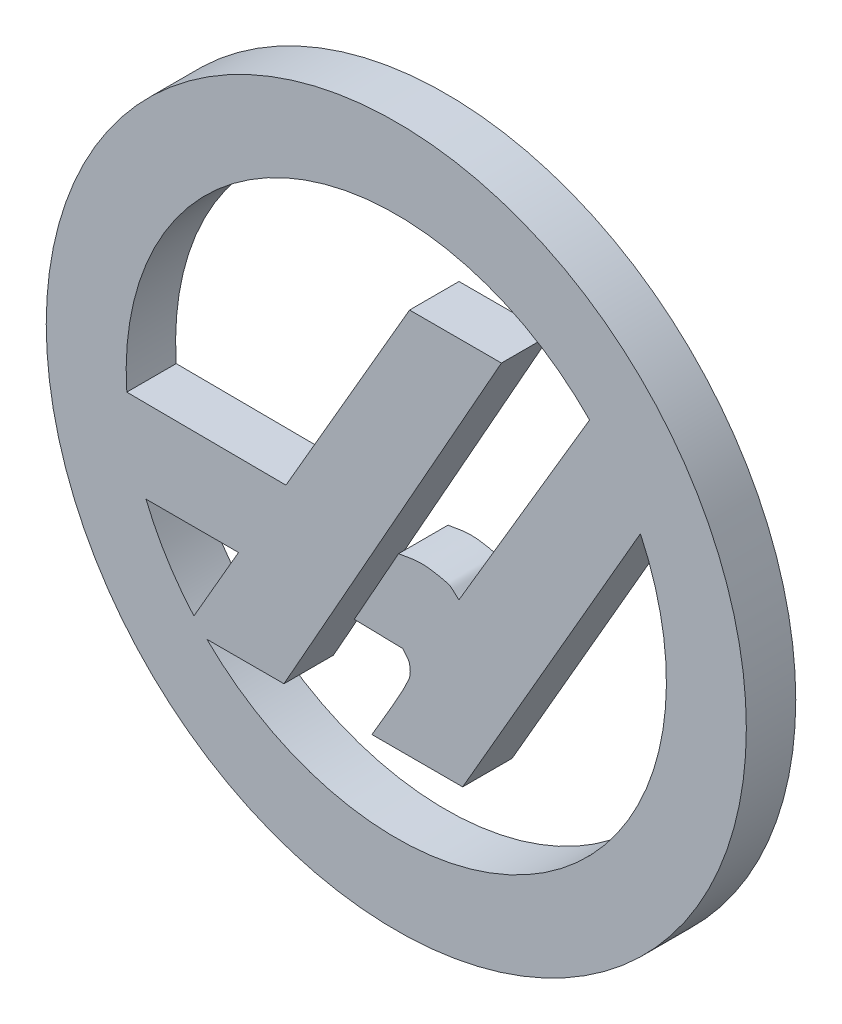
from build123d import *

# Parameters (mm, degrees)
SKETCH1_R           = 354.154198638
BOSS_EXTRUDE4_DEPTH = 50


with BuildPart() as part:
    # Sketch1 → Boss-Extrude4 (new body)
    with BuildSketch(Plane.XY):
        with Locations((456.634031844, 370.797239723)):
            Circle(SKETCH1_R)
        with BuildLine():
            Line((652.184505988, 561.696856288), (520, 338))
            add(Edge.make_bspline(
                [(520, 338), (516, 341), (512.856486558, 345.810656353), (508, 347), (483.294181497, 353.050404531), (477.851743634, 351.141957272), (459, 348)],
                knots=[0, 0, 0, 0, 1, 1, 1, 2, 2, 2, 2], degree=3))
            Line((459, 348), (414.15311107, 268.000000001))
            Line((414.15311107, 268.000000001), (463, 267))
            add(Edge.make_bspline(
                [(463, 267), (465.333333333, 263.666666667), (469.050440025, 260.956499894), (470, 257), (471.16945492, 252.127271165), (471.128314939, 246.536671316), (469, 242), (458.288028235, 219.166586501), (444.333333333, 198), (432, 176)],
                knots=[0, 0, 0, 0, 1, 1, 1, 2, 2, 2, 3, 3, 3, 3], degree=3))
            Line((432, 176), (523.783724069, 176))
            Line((523.783724069, 176), (703.607534398, 487.787583679))
            ThreePointArc((703.607534398, 487.787583679), (614.979125151, 148.065376335), (264.996930573, 175.96943637))
            Line((264.996930573, 175.96943637), (342.999405137, 176))
            Line((342.999405137, 176), (562.999999995, 567.000000012))
            Line((562.999999995, 567.000000012), (470.080751257, 567.000000012))
            Line((470.080751257, 567.000000012), (344.999999995, 351.000000012))
            Line((344.999999995, 351.000000012), (183.999999995, 352.000000012))
            ThreePointArc((183.999999995, 352.000000012), (344.926101955, 620.204516968), (652.184505988, 561.696856288))
        make_face(mode=Mode.SUBTRACT)
        with BuildLine():
            Line((203.423883848, 268.000000001), (297, 268.000000001))
            Line((297, 268.000000001), (251.884299831, 189.799453042))
            ThreePointArc((251.884299831, 189.799453042), (224.339726467, 226.845833922), (203.423883848, 268.000000001))
        make_face(mode=Mode.SUBTRACT)
    extrude(amount=BOSS_EXTRUDE4_DEPTH)


solid = part.part
